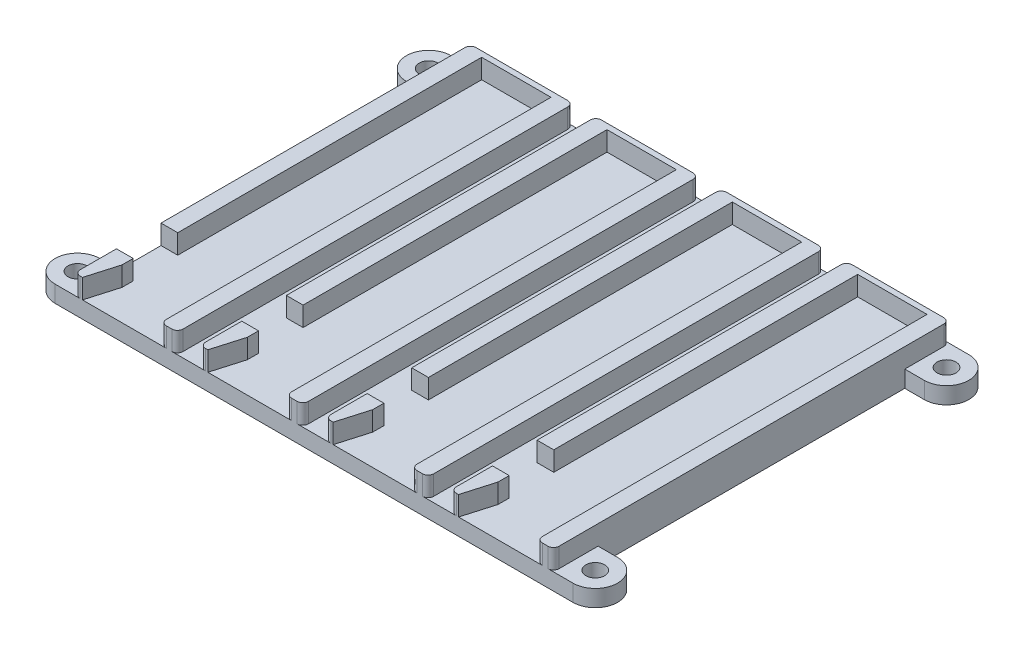
from build123d import *

# Parameters (mm, degrees)
SKETCH_2_R      = 1.7
EXTRUDE_1_DEPTH = 3
EXTRUDE_2_DEPTH = 3.5
FILLET_5_R      = 1


with BuildPart() as part:
    # ｽｹｯﾁ2 → ﾎﾞｽ - 押し出し1 (new body)
    with BuildSketch(Plane(origin=(0, 0, 0), x_dir=(1, 0, 0), z_dir=(0, 1, 0))):
        with BuildLine():
            Line((85.95, 71.05), (89.45, 71.05))
            ThreePointArc((89.45, 71.05), (93.45, 67.05), (89.45, 63.05))
            Line((89.45, 63.05), (85.95, 63.05))
            Line((85.95, 63.05), (85.95, 8))
            Line((85.95, 8), (89.45, 8))
            ThreePointArc((89.45, 8), (93.45, 4), (89.45, 0))
            Line((89.45, 0), (85.95, 0))
            Line((85.95, 0), (0, 0))
            Line((0, 0), (-3.5, 0))
            ThreePointArc((-3.5, 0), (-7.5, 4), (-3.5, 8))
            Line((-3.5, 8), (0, 8))
            Line((0, 8), (0, 63.05))
            Line((0, 63.05), (-3.5, 63.05))
            ThreePointArc((-3.5, 63.05), (-7.5, 67.05), (-3.5, 71.05))
            Line((-3.5, 71.05), (0, 71.05))
            Line((0, 71.05), (85.95, 71.05))
        make_face()
        with Locations(Location((89.45, 67.05, 0), (0, 0, 270))):
            Circle(SKETCH_2_R, mode=Mode.SUBTRACT)
        with Locations(Location((89.45, 4, 0), (0, 0, 270))):
            Circle(SKETCH_2_R, mode=Mode.SUBTRACT)
        with Locations(Location((-3.5, 67.05, 0), (0, 0, 270))):
            Circle(SKETCH_2_R, mode=Mode.SUBTRACT)
        with Locations(Location((-3.5, 4, 0), (0, 0, 270))):
            Circle(SKETCH_2_R, mode=Mode.SUBTRACT)
    extrude(amount=EXTRUDE_1_DEPTH)

    # ｽｹｯﾁ3 → ﾎﾞｽ - 押し出し2 (add)
    with BuildSketch(Plane(origin=(0, 3, 0), x_dir=(1, 0, 0), z_dir=(0, 1, 0))):
        Polygon((68.9, 0), (70.5, 5.5), (70.5, 7.5), (67.5, 7.5), (67.5, 0), align=None)
        Polygon((67.5, 15.5), (70.5, 15.5), (70.5, 70.05), (82.95, 70.05), (82.95, 0), (85.95, 0), (85.95, 71.05), (67.5, 71.05), align=None)
        Polygon((45, 15.5), (48, 15.5), (48, 70.05), (60.45, 70.05), (60.45, 0), (63.45, 0), (63.45, 71.05), (45, 71.05), align=None)
        Polygon((46.4, 0), (48, 5.5), (48, 7.5), (45, 7.5), (45, 0), align=None)
        Polygon((22.5, 15.5), (25.5, 15.5), (25.5, 70.05), (37.95, 70.05), (37.95, 0), (40.95, 0), (40.95, 71.05), (22.5, 71.05), align=None)
        Polygon((23.9, 0), (25.5, 5.5), (25.5, 7.5), (22.5, 7.5), (22.5, 0), align=None)
        Polygon((0, 15.5), (3, 15.5), (3, 70.05), (15.45, 70.05), (15.45, 0), (18.45, 0), (18.45, 71.05), (0, 71.05), align=None)
        Polygon((1.4, 0), (3, 5.5), (3, 7.5), (0, 7.5), (0, 0), align=None)
    extrude(amount=EXTRUDE_2_DEPTH)

    # ﾌｨﾚｯﾄ5
    fillet_5_edges = [part.edges().sort_by_distance(p)[0] for p in [
        (85.95, 4.75, 0),
        (85.95, 4.75, -71.05),
        (45, 4.75, -71.05),
        (60.45, 4.75, 0),
        (63.45, 4.75, 0),
        (63.45, 4.75, -71.05),
        (22.5, 4.75, 0),
        (22.5, 4.75, -71.05),
        (37.95, 4.75, 0),
        (40.95, 4.75, 0),
        (40.95, 4.75, -71.05),
        (0, 4.75, 0),
        (0, 4.75, -71.05),
        (15.45, 4.75, 0),
        (18.45, 4.75, 0),
        (18.45, 4.75, -71.05),
        (67.5, 4.75, 0),
        (45, 4.75, 0),
        (67.5, 4.75, -71.05),
        (82.95, 4.75, 0),
    ]]
    fillet(fillet_5_edges, radius=FILLET_5_R)


solid = part.part
